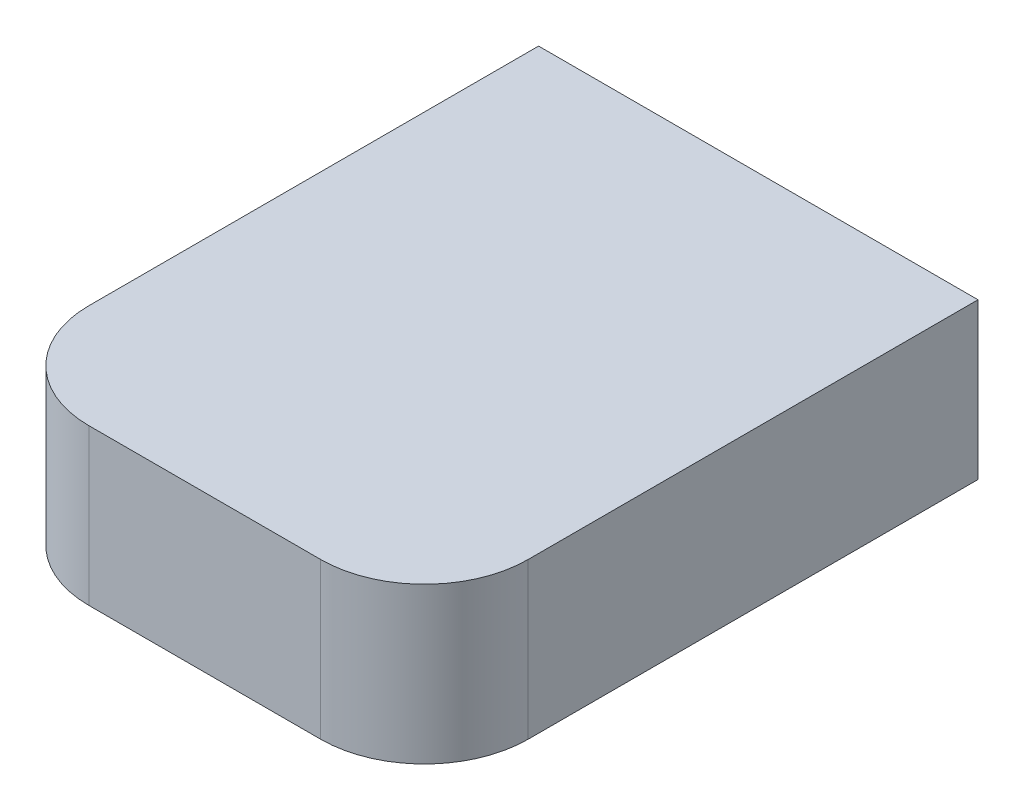
from build123d import *

# Parameters (mm, degrees)
SKETCH1_W           = 12.7
SKETCH1_H           = 4.5
BOSS_EXTRUDE1_DEPTH = 16
FILLET1_R           = 3
FILLET2_R           = 3


with BuildPart() as part:
    # Sketch1 → Boss-Extrude1 (new body)
    with BuildSketch(Plane.XY):
        with Locations((122.7, -2.25)):
            Rectangle(SKETCH1_W, SKETCH1_H)
    extrude(amount=BOSS_EXTRUDE1_DEPTH)

    # Fillet1
    fillet1_edges = [part.edges().sort_by_distance(p)[0] for p in [
        (129.05, -2.25, 16),
    ]]
    fillet(fillet1_edges, radius=FILLET1_R)

    # Fillet2
    fillet2_edges = [part.edges().sort_by_distance(p)[0] for p in [
        (116.35, -2.25, 16),
    ]]
    fillet(fillet2_edges, radius=FILLET2_R)


solid = part.part
